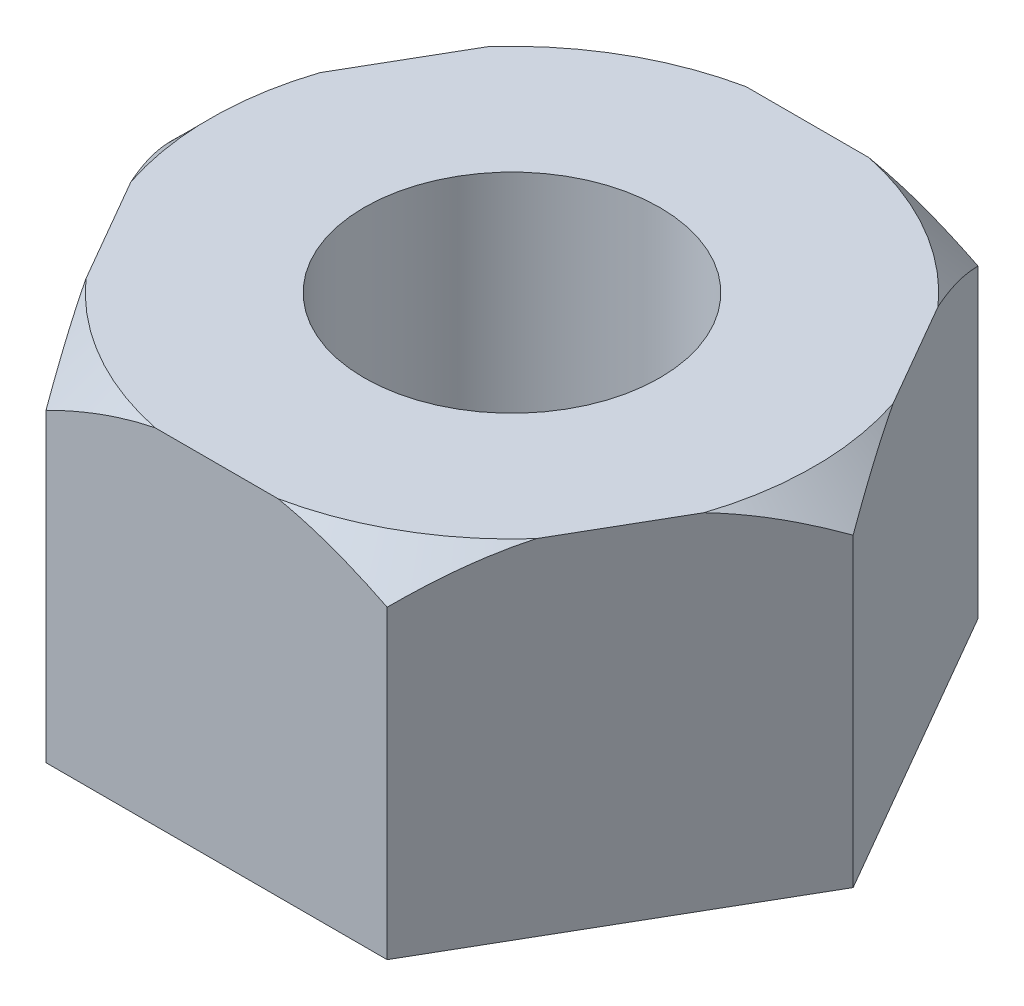
from build123d import *

# Parameters (mm, degrees)
BOSS_EXTRUDE1_DEPTH = 35
SKETCH8_R           = 15
CUT_EXTRUDE1_DEPTH  = 58.662812973


with BuildPart() as part:
    # Sketch1 → Boss-Extrude1 (new body)
    with BuildSketch(Plane(origin=(0, 0, 0), x_dir=(1, 0, 0), z_dir=(0, 1, 0))):
        Polygon((-17.320508076, -30), (17.320508076, -30), (34.641016151, 0), (-34.641016151, 0), align=None)
        Polygon((-34.641016151, 0), (34.641016151, 0), (17.320508076, 30), (-17.320508076, 30), align=None)
    extrude(amount=BOSS_EXTRUDE1_DEPTH)

    # Sketch6 → Cut-Revolve2 (revolve, cut)
    with BuildSketch(Plane.XY):
        Polygon((30.641016151, 35), (34.641016151, 31), (34.641016151, 35), align=None)
    revolve(axis=Axis((0, 42.436882795, 0), (0, -1, 0)), mode=Mode.SUBTRACT)

    # Sketch8 → Cut-Extrude1 (cut, through all)
    with BuildSketch(Plane(origin=(0, 0, 0), x_dir=(-1, 0, 0), z_dir=(0, -1, 0))):
        with Locations(Location((0, 0, 0), (0, 0, 90))):
            Circle(SKETCH8_R)
    extrude(amount=-CUT_EXTRUDE1_DEPTH, mode=Mode.SUBTRACT)


solid = part.part
